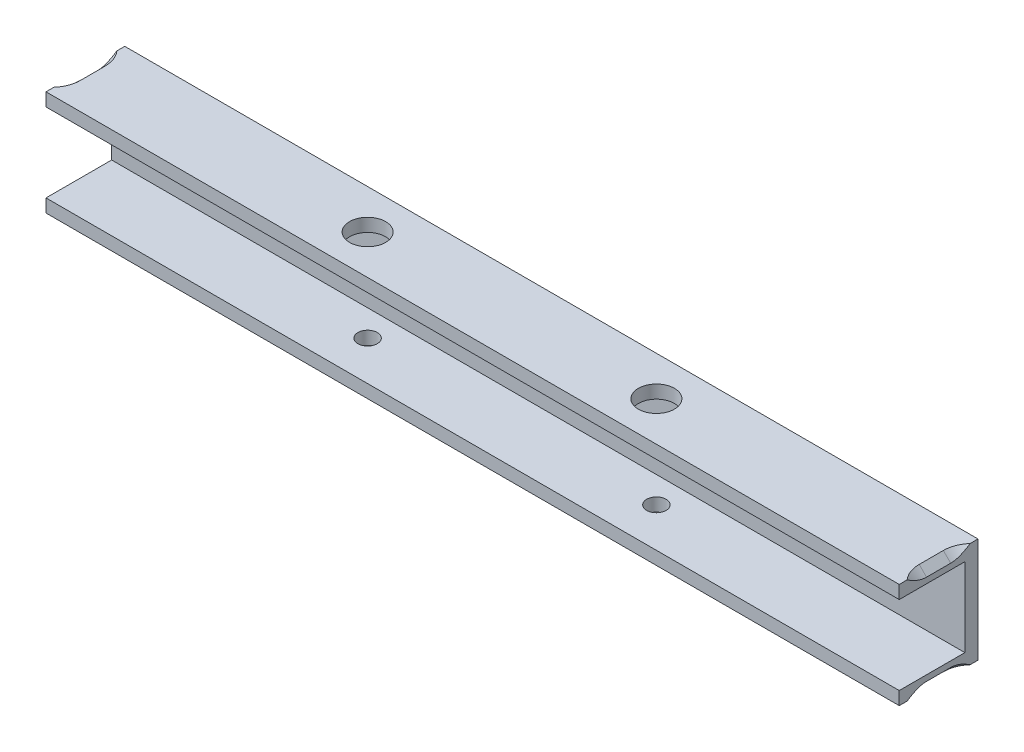
from build123d import *

# Parameters (mm, degrees)
BOSS_EXTRUDE1_DEPTH = 103.1875
CUT_EXTRUDE2_REACH  = 109.962
SKETCH3_R           = 2.3495
CUT_EXTRUDE3_REACH  = 109.962
SKETCH4_R           = 4.36626
CUT_EXTRUDE4_REACH  = 109.962
SKETCH5_R           = 3.175


with BuildPart() as part:
    # Sketch1 → Boss-Extrude1 (new, symmetric)
    with BuildSketch(Plane(origin=(0, 0, 0), x_dir=(0, 0, -1), z_dir=(1, 0, 0))):
        Polygon((0, 25.4), (-19.05, 25.4), (-19.05, 22.225), (-3.175, 22.225), (-3.175, 3.175), (-19.05, 3.175), (-19.05, 0), (0, 0), align=None)
    extrude(amount=BOSS_EXTRUDE1_DEPTH, both=True)

    # Sketch3 → Cut-Extrude2 (cut, up to next)
    with BuildSketch(Plane.XZ, mode=Mode.PRIVATE) as cut_extrude2_sk1:
        with Locations(Location((34.925, 9.525, 0), (0, 0, 270))):
            Circle(SKETCH3_R)
    cut_extrude2_tool1 = extrude(cut_extrude2_sk1.sketch, amount=-CUT_EXTRUDE2_REACH, mode=Mode.PRIVATE) & part.part
    # Sketch3 → Cut-Extrude2 (cut, up to next)
    with BuildSketch(Plane.XZ, mode=Mode.PRIVATE) as cut_extrude2_sk2:
        with Locations(Location((-34.925, 9.525, 0), (0, 0, 270))):
            Circle(SKETCH3_R)
    cut_extrude2_tool2 = extrude(cut_extrude2_sk2.sketch, amount=-CUT_EXTRUDE2_REACH, mode=Mode.PRIVATE) & part.part
    add(cut_extrude2_tool1.solids().sort_by_distance((34.925, 0, 9.525))[0], mode=Mode.SUBTRACT)
    add(cut_extrude2_tool2.solids().sort_by_distance((-34.925, 0, 9.525))[0], mode=Mode.SUBTRACT)

    # Sketch4 → Cut-Extrude3 (cut, up to next)
    with BuildSketch(Plane(origin=(0, 25.4, 0), x_dir=(1, 0, 0), z_dir=(0, 1, 0)), mode=Mode.PRIVATE) as cut_extrude3_sk1:
        with Locations(Location((-34.925, -9.525, 0), (0, 0, 270))):
            Circle(SKETCH4_R)
    cut_extrude3_tool1 = extrude(cut_extrude3_sk1.sketch, amount=-CUT_EXTRUDE3_REACH, mode=Mode.PRIVATE) & part.part
    # Sketch4 → Cut-Extrude3 (cut, up to next)
    with BuildSketch(Plane(origin=(0, 25.4, 0), x_dir=(1, 0, 0), z_dir=(0, 1, 0)), mode=Mode.PRIVATE) as cut_extrude3_sk2:
        with Locations(Location((34.925, -9.525, 0), (0, 0, 270))):
            Circle(SKETCH4_R)
    cut_extrude3_tool2 = extrude(cut_extrude3_sk2.sketch, amount=-CUT_EXTRUDE3_REACH, mode=Mode.PRIVATE) & part.part
    add(cut_extrude3_tool1.solids().sort_by_distance((-34.925, 25.4, 9.525))[0], mode=Mode.SUBTRACT)
    add(cut_extrude3_tool2.solids().sort_by_distance((34.925, 25.4, 9.525))[0], mode=Mode.SUBTRACT)

    # Sketch5 → Cut-Extrude4 (cut, up to next)
    with BuildSketch(Plane(origin=(0, 0, 0), x_dir=(-1, 0, 0), z_dir=(0, 0, -1)), mode=Mode.PRIVATE) as cut_extrude4_sk1:
        with Locations((-76.2, 15.875)):
            Circle(SKETCH5_R)
    cut_extrude4_tool1 = extrude(cut_extrude4_sk1.sketch, amount=-CUT_EXTRUDE4_REACH, mode=Mode.PRIVATE) & part.part
    # Sketch5 → Cut-Extrude4 (cut, up to next)
    with BuildSketch(Plane(origin=(0, 0, 0), x_dir=(-1, 0, 0), z_dir=(0, 0, -1)), mode=Mode.PRIVATE) as cut_extrude4_sk2:
        with Locations((76.2, 15.875)):
            Circle(SKETCH5_R)
    cut_extrude4_tool2 = extrude(cut_extrude4_sk2.sketch, amount=-CUT_EXTRUDE4_REACH, mode=Mode.PRIVATE) & part.part
    add(cut_extrude4_tool1.solids().sort_by_distance((76.2, 15.875, 0))[0], mode=Mode.SUBTRACT)
    add(cut_extrude4_tool2.solids().sort_by_distance((-76.2, 15.875, 0))[0], mode=Mode.SUBTRACT)

    # Cut-Sweep1: sweep along a path in Sketch6
    with BuildLine(Plane(origin=(0, 25.4, 0), x_dir=(1, 0, 0), z_dir=(0, 1, 0))) as cut_sweep1_path:
        Line((-111.0615, 0.508), (-108.5215, 0.508))
        ThreePointArc((-108.5215, 0.508), (-103.492556572, -1.575056572), (-101.4095, -6.604))
        Line((-101.4095, -6.604), (-101.4095, -12.446))
        ThreePointArc((-101.4095, -12.446), (-103.492556572, -17.474943428), (-108.5215, -19.558))
        Line((-108.5215, -19.558), (-111.0615, -19.558))
    # Sketch7 → Cut-Sweep1 (sweep, cut)
    with BuildSketch(Plane(origin=(-111.0615, 25.4, -0.508), x_dir=(0, 0, -1), z_dir=(1, 0, 0))):
        Polygon((-4.572, -4.572), (-4.572, 0.508), (0.508, 0.508), align=None)
        Polygon((-4.572, -20.828), (-4.572, -25.908), (0.508, -25.908), align=None)
    cut_sweep1 = sweep(path=cut_sweep1_path.line, mode=Mode.SUBTRACT)

    # Mirror1: Cut-Sweep1 across plane
    add(cut_sweep1.mirror(Plane(origin=(0, 0, 0), x_dir=(0, 0, 1), z_dir=(1, 0, 0))), mode=Mode.SUBTRACT)


solid = part.part
